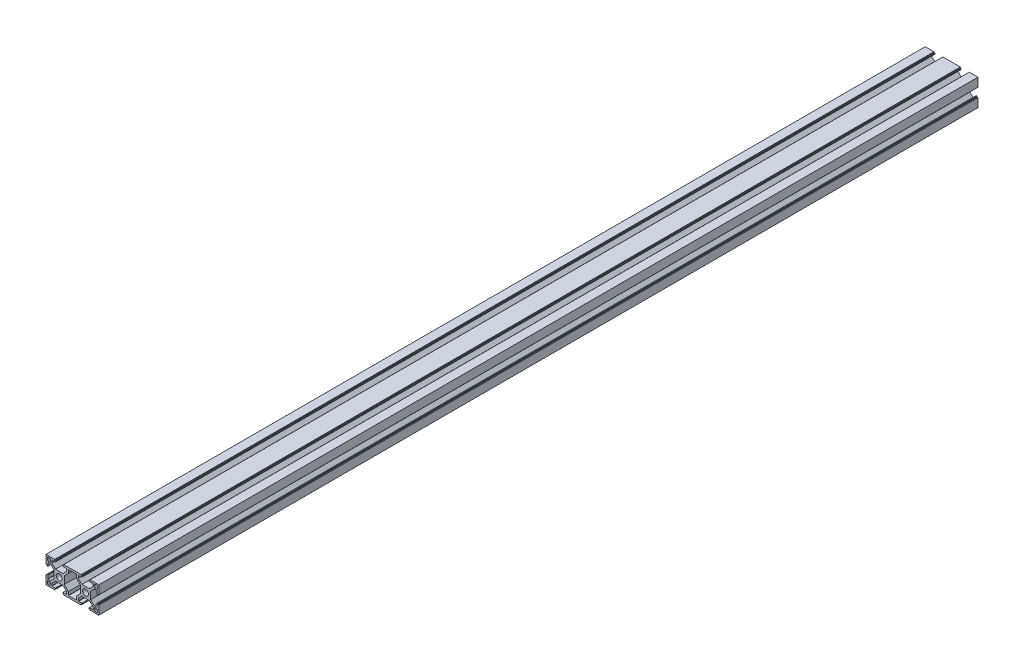
from build123d import *

# Parameters (mm, degrees)
SKETCH_1_R      = 3.4
EXTRUDE_1_DEPTH = 1000


with BuildPart() as part:
    # 草图1 → 凸台-拉伸1 (new body)
    with BuildSketch(Plane.XY):
        with BuildLine():
            Line((-34.860338488, 11.460591472), (-34.860338488, 4.060591472))
            Line((-34.860338488, 4.060591472), (-34.060338488, 4.060591472))
            ThreePointArc((-34.060338488, 4.060591472), (-33.918917132, 4.002012828), (-33.860338488, 3.860591472))
            Line((-33.860338488, 3.860591472), (-33.860338488, 3.060591472))
            Line((-33.860338488, 3.060591472), (-32.960338488, 3.060591472))
            ThreePointArc((-32.960338488, 3.060591472), (-32.748206454, 3.148459437), (-32.660338488, 3.360591472))
            Line((-32.660338488, 3.360591472), (-32.660338488, 6.910591472))
            ThreePointArc((-32.660338488, 6.910591472), (-32.572470523, 7.122723506), (-32.360338488, 7.210591472))
            Line((-32.360338488, 7.210591472), (-29.665973407, 7.210591472))
            Line((-29.665973407, 7.210591472), (-25.660338488, 3.204956553))
            Line((-25.660338488, 3.204956553), (-25.660338488, -5.28377361))
            Line((-25.660338488, -5.28377361), (-29.665973407, -9.289408528))
            Line((-29.665973407, -9.289408528), (-32.360338488, -9.289408528))
            ThreePointArc((-32.360338488, -9.289408528), (-32.572470523, -9.201540563), (-32.660338488, -8.989408528))
            Line((-32.660338488, -8.989408528), (-32.660338488, -5.439408528))
            ThreePointArc((-32.660338488, -5.439408528), (-32.748206454, -5.227276494), (-32.960338488, -5.139408528))
            Line((-32.960338488, -5.139408528), (-33.860338488, -5.139408528))
            Line((-33.860338488, -5.139408528), (-33.860338488, -5.939408528))
            ThreePointArc((-33.860338488, -5.939408528), (-33.918917132, -6.080829884), (-34.060338488, -6.139408528))
            Line((-34.060338488, -6.139408528), (-34.860338488, -6.139408528))
            Line((-34.860338488, -6.139408528), (-34.860338488, -13.539408528))
            Line((-34.860338488, -13.539408528), (-34.860338488, -16.039408528))
            Line((-34.860338488, -16.039408528), (-32.360338488, -16.039408528))
            Line((-32.360338488, -16.039408528), (-24.960338488, -16.039408528))
            Line((-24.960338488, -16.039408528), (-24.960338488, -15.239408528))
            ThreePointArc((-24.960338488, -15.239408528), (-24.901759845, -15.097987172), (-24.760338488, -15.039408528))
            Line((-24.760338488, -15.039408528), (-23.960338488, -15.039408528))
            Line((-23.960338488, -15.039408528), (-23.960338488, -14.139408528))
            ThreePointArc((-23.960338488, -14.139408528), (-24.048206454, -13.927276494), (-24.260338488, -13.839408528))
            Line((-24.260338488, -13.839408528), (-27.810338488, -13.839408528))
            ThreePointArc((-27.810338488, -13.839408528), (-28.022470523, -13.751540563), (-28.110338488, -13.539408528))
            Line((-28.110338488, -13.539408528), (-28.110338488, -10.845043447))
            Line((-28.110338488, -10.845043447), (-24.10470357, -6.839408528))
            Line((-24.10470357, -6.839408528), (-15.615973407, -6.839408528))
            Line((-15.615973407, -6.839408528), (-11.610338488, -10.845043447))
            Line((-11.610338488, -10.845043447), (-11.610338488, -13.539408528))
            ThreePointArc((-11.610338488, -13.539408528), (-11.698206454, -13.751540563), (-11.910338488, -13.839408528))
            Line((-11.910338488, -13.839408528), (-15.460338488, -13.839408528))
            ThreePointArc((-15.460338488, -13.839408528), (-15.672470523, -13.927276494), (-15.760338488, -14.139408528))
            Line((-15.760338488, -14.139408528), (-15.760338488, -15.039408528))
            Line((-15.760338488, -15.039408528), (-14.960338488, -15.039408528))
            ThreePointArc((-14.960338488, -15.039408528), (-14.818917132, -15.097987172), (-14.760338488, -15.239408528))
            Line((-14.760338488, -15.239408528), (-14.760338488, -16.039408528))
            Line((-14.760338488, -16.039408528), (-7.360338488, -16.039408528))
            Line((-7.360338488, -16.039408528), (-4.860338488, -16.039408528))
            Line((-4.860338488, -16.039408528), (-2.360338488, -16.039408528))
            Line((-2.360338488, -16.039408528), (5.039661512, -16.039408528))
            Line((5.039661512, -16.039408528), (5.039661512, -15.239408528))
            ThreePointArc((5.039661512, -15.239408528), (5.098240155, -15.097987172), (5.239661512, -15.039408528))
            Line((5.239661512, -15.039408528), (6.039661512, -15.039408528))
            Line((6.039661512, -15.039408528), (6.039661512, -14.139408528))
            ThreePointArc((6.039661512, -14.139408528), (5.951793546, -13.927276494), (5.739661512, -13.839408528))
            Line((5.739661512, -13.839408528), (2.189661512, -13.839408528))
            ThreePointArc((2.189661512, -13.839408528), (1.977529477, -13.751540563), (1.889661512, -13.539408528))
            Line((1.889661512, -13.539408528), (1.889661512, -10.845043447))
            Line((1.889661512, -10.845043447), (5.89529643, -6.839408528))
            Line((5.89529643, -6.839408528), (14.384026593, -6.839408528))
            Line((14.384026593, -6.839408528), (18.389661512, -10.845043447))
            Line((18.389661512, -10.845043447), (18.389661512, -13.539408528))
            ThreePointArc((18.389661512, -13.539408528), (18.301793546, -13.751540563), (18.089661512, -13.839408528))
            Line((18.089661512, -13.839408528), (14.539661512, -13.839408528))
            ThreePointArc((14.539661512, -13.839408528), (14.327529477, -13.927276494), (14.239661512, -14.139408528))
            Line((14.239661512, -14.139408528), (14.239661512, -15.039408528))
            Line((14.239661512, -15.039408528), (15.039661512, -15.039408528))
            ThreePointArc((15.039661512, -15.039408528), (15.181082868, -15.097987172), (15.239661512, -15.239408528))
            Line((15.239661512, -15.239408528), (15.239661512, -16.039408528))
            Line((15.239661512, -16.039408528), (22.639661512, -16.039408528))
            Line((22.639661512, -16.039408528), (25.139661512, -16.039408528))
            Line((25.139661512, -16.039408528), (25.139661512, -13.539408528))
            Line((25.139661512, -13.539408528), (25.139661512, -6.139408528))
            Line((25.139661512, -6.139408528), (24.339661512, -6.139408528))
            ThreePointArc((24.339661512, -6.139408528), (24.198240155, -6.080829884), (24.139661512, -5.939408528))
            Line((24.139661512, -5.939408528), (24.139661512, -5.139408528))
            Line((24.139661512, -5.139408528), (23.239661512, -5.139408528))
            ThreePointArc((23.239661512, -5.139408528), (23.027529477, -5.227276494), (22.939661512, -5.439408528))
            Line((22.939661512, -5.439408528), (22.939661512, -8.989408528))
            ThreePointArc((22.939661512, -8.989408528), (22.851793546, -9.201540563), (22.639661512, -9.289408528))
            Line((22.639661512, -9.289408528), (19.94529643, -9.289408528))
            Line((19.94529643, -9.289408528), (15.939661512, -5.28377361))
            Line((15.939661512, -5.28377361), (15.939661512, 3.204956553))
            Line((15.939661512, 3.204956553), (19.94529643, 7.210591472))
            Line((19.94529643, 7.210591472), (22.639661512, 7.210591472))
            ThreePointArc((22.639661512, 7.210591472), (22.851793546, 7.122723506), (22.939661512, 6.910591472))
            Line((22.939661512, 6.910591472), (22.939661512, 3.360591472))
            ThreePointArc((22.939661512, 3.360591472), (23.027529477, 3.148459437), (23.239661512, 3.060591472))
            Line((23.239661512, 3.060591472), (24.139661512, 3.060591472))
            Line((24.139661512, 3.060591472), (24.139661512, 3.860591472))
            ThreePointArc((24.139661512, 3.860591472), (24.198240155, 4.002012828), (24.339661512, 4.060591472))
            Line((24.339661512, 4.060591472), (25.139661512, 4.060591472))
            Line((25.139661512, 4.060591472), (25.139661512, 11.460591472))
            Line((25.139661512, 11.460591472), (25.139661512, 13.960591472))
            Line((25.139661512, 13.960591472), (22.639661512, 13.960591472))
            Line((22.639661512, 13.960591472), (15.239661512, 13.960591472))
            Line((15.239661512, 13.960591472), (15.239661512, 13.160591472))
            ThreePointArc((15.239661512, 13.160591472), (15.181082868, 13.019170116), (15.039661512, 12.960591472))
            Line((15.039661512, 12.960591472), (14.239661512, 12.960591472))
            Line((14.239661512, 12.960591472), (14.239661512, 12.060591472))
            ThreePointArc((14.239661512, 12.060591472), (14.327529477, 11.848459437), (14.539661512, 11.760591472))
            Line((14.539661512, 11.760591472), (18.089661512, 11.760591472))
            ThreePointArc((18.089661512, 11.760591472), (18.301793546, 11.672723506), (18.389661512, 11.460591472))
            Line((18.389661512, 11.460591472), (18.389661512, 8.76622639))
            Line((18.389661512, 8.76622639), (14.384026593, 4.760591472))
            Line((14.384026593, 4.760591472), (5.89529643, 4.760591472))
            Line((5.89529643, 4.760591472), (1.889661512, 8.76622639))
            Line((1.889661512, 8.76622639), (1.889661512, 11.460591472))
            ThreePointArc((1.889661512, 11.460591472), (1.977529477, 11.672723506), (2.189661512, 11.760591472))
            Line((2.189661512, 11.760591472), (5.739661512, 11.760591472))
            ThreePointArc((5.739661512, 11.760591472), (5.951793546, 11.848459437), (6.039661512, 12.060591472))
            Line((6.039661512, 12.060591472), (6.039661512, 12.960591472))
            Line((6.039661512, 12.960591472), (5.239661512, 12.960591472))
            ThreePointArc((5.239661512, 12.960591472), (5.098240155, 13.019170116), (5.039661512, 13.160591472))
            Line((5.039661512, 13.160591472), (5.039661512, 13.960591472))
            Line((5.039661512, 13.960591472), (-2.360338488, 13.960591472))
            Line((-2.360338488, 13.960591472), (-4.860338488, 13.960591472))
            Line((-4.860338488, 13.960591472), (-7.360338488, 13.960591472))
            Line((-7.360338488, 13.960591472), (-14.760338488, 13.960591472))
            Line((-14.760338488, 13.960591472), (-14.760338488, 13.160591472))
            ThreePointArc((-14.760338488, 13.160591472), (-14.818917132, 13.019170116), (-14.960338488, 12.960591472))
            Line((-14.960338488, 12.960591472), (-15.760338488, 12.960591472))
            Line((-15.760338488, 12.960591472), (-15.760338488, 12.060591472))
            ThreePointArc((-15.760338488, 12.060591472), (-15.672470523, 11.848459437), (-15.460338488, 11.760591472))
            Line((-15.460338488, 11.760591472), (-11.910338488, 11.760591472))
            ThreePointArc((-11.910338488, 11.760591472), (-11.698206454, 11.672723506), (-11.610338488, 11.460591472))
            Line((-11.610338488, 11.460591472), (-11.610338488, 8.76622639))
            Line((-11.610338488, 8.76622639), (-15.615973407, 4.760591472))
            Line((-15.615973407, 4.760591472), (-24.10470357, 4.760591472))
            Line((-24.10470357, 4.760591472), (-28.110338488, 8.76622639))
            Line((-28.110338488, 8.76622639), (-28.110338488, 11.460591472))
            ThreePointArc((-28.110338488, 11.460591472), (-28.022470523, 11.672723506), (-27.810338488, 11.760591472))
            Line((-27.810338488, 11.760591472), (-24.260338488, 11.760591472))
            ThreePointArc((-24.260338488, 11.760591472), (-24.048206454, 11.848459437), (-23.960338488, 12.060591472))
            Line((-23.960338488, 12.060591472), (-23.960338488, 12.960591472))
            Line((-23.960338488, 12.960591472), (-24.760338488, 12.960591472))
            ThreePointArc((-24.760338488, 12.960591472), (-24.901759845, 13.019170116), (-24.960338488, 13.160591472))
            Line((-24.960338488, 13.160591472), (-24.960338488, 13.960591472))
            Line((-24.960338488, 13.960591472), (-32.360338488, 13.960591472))
            Line((-32.360338488, 13.960591472), (-34.860338488, 13.960591472))
            Line((-34.860338488, 13.960591472), (-34.860338488, 11.460591472))
        make_face()
        with Locations((-19.860338488, -1.039408528)):
            Circle(SKETCH_1_R, mode=Mode.SUBTRACT)
        with Locations((10.139661512, -1.039408528)):
            Circle(SKETCH_1_R, mode=Mode.SUBTRACT)
        with BuildLine():
            Line((-29.610338488, -11.789408528), (-29.610338488, -13.539408528))
            ThreePointArc((-29.610338488, -13.539408528), (-29.903231707, -14.246515309), (-30.610338488, -14.539408528))
            Line((-30.610338488, -14.539408528), (-32.360338488, -14.539408528))
            ThreePointArc((-32.360338488, -14.539408528), (-33.06744527, -14.246515309), (-33.360338488, -13.539408528))
            Line((-33.360338488, -13.539408528), (-33.360338488, -11.789408528))
            ThreePointArc((-33.360338488, -11.789408528), (-33.06744527, -11.082301747), (-32.360338488, -10.789408528))
            Line((-32.360338488, -10.789408528), (-30.610338488, -10.789408528))
            ThreePointArc((-30.610338488, -10.789408528), (-29.903231707, -11.082301747), (-29.610338488, -11.789408528))
        make_face(mode=Mode.SUBTRACT)
        with BuildLine():
            Line((-30.610338488, 8.710591472), (-32.360338488, 8.710591472))
            ThreePointArc((-32.360338488, 8.710591472), (-33.06744527, 9.003484691), (-33.360338488, 9.710591472))
            Line((-33.360338488, 9.710591472), (-33.360338488, 11.460591472))
            ThreePointArc((-33.360338488, 11.460591472), (-33.06744527, 12.167698253), (-32.360338488, 12.460591472))
            Line((-32.360338488, 12.460591472), (-30.610338488, 12.460591472))
            ThreePointArc((-30.610338488, 12.460591472), (-29.903231707, 12.167698253), (-29.610338488, 11.460591472))
            Line((-29.610338488, 11.460591472), (-29.610338488, 9.710591472))
            ThreePointArc((-29.610338488, 9.710591472), (-29.903231707, 9.003484691), (-30.610338488, 8.710591472))
        make_face(mode=Mode.SUBTRACT)
        with BuildLine():
            Line((-14.060338488, -5.28377361), (-14.060338488, 3.204956553))
            Line((-14.060338488, 3.204956553), (-9.410338488, 7.854956553))
            Line((-9.410338488, 7.854956553), (-9.410338488, 11.460591472))
            ThreePointArc((-9.410338488, 11.460591472), (-9.322470523, 11.672723506), (-9.110338488, 11.760591472))
            Line((-9.110338488, 11.760591472), (-0.610338488, 11.760591472))
            ThreePointArc((-0.610338488, 11.760591472), (-0.398206454, 11.672723506), (-0.310338488, 11.460591472))
            Line((-0.310338488, 11.460591472), (-0.310338488, 7.854956553))
            Line((-0.310338488, 7.854956553), (4.339661512, 3.204956553))
            Line((4.339661512, 3.204956553), (4.339661512, -5.28377361))
            Line((4.339661512, -5.28377361), (-0.310338488, -9.93377361))
            Line((-0.310338488, -9.93377361), (-0.310338488, -13.539408528))
            ThreePointArc((-0.310338488, -13.539408528), (-0.398206454, -13.751540563), (-0.610338488, -13.839408528))
            Line((-0.610338488, -13.839408528), (-9.110338488, -13.839408528))
            ThreePointArc((-9.110338488, -13.839408528), (-9.322470523, -13.751540563), (-9.410338488, -13.539408528))
            Line((-9.410338488, -13.539408528), (-9.410338488, -9.93377361))
            Line((-9.410338488, -9.93377361), (-14.060338488, -5.28377361))
        make_face(mode=Mode.SUBTRACT)
        with BuildLine():
            Line((19.889661512, 9.710591472), (19.889661512, 11.460591472))
            ThreePointArc((19.889661512, 11.460591472), (20.18255473, 12.167698253), (20.889661512, 12.460591472))
            Line((20.889661512, 12.460591472), (22.639661512, 12.460591472))
            ThreePointArc((22.639661512, 12.460591472), (23.346768293, 12.167698253), (23.639661512, 11.460591472))
            Line((23.639661512, 11.460591472), (23.639661512, 9.710591472))
            ThreePointArc((23.639661512, 9.710591472), (23.346768293, 9.003484691), (22.639661512, 8.710591472))
            Line((22.639661512, 8.710591472), (20.889661512, 8.710591472))
            ThreePointArc((20.889661512, 8.710591472), (20.18255473, 9.003484691), (19.889661512, 9.710591472))
        make_face(mode=Mode.SUBTRACT)
        with BuildLine():
            Line((20.889661512, -10.789408528), (22.639661512, -10.789408528))
            ThreePointArc((22.639661512, -10.789408528), (23.346768293, -11.082301747), (23.639661512, -11.789408528))
            Line((23.639661512, -11.789408528), (23.639661512, -13.539408528))
            ThreePointArc((23.639661512, -13.539408528), (23.346768293, -14.246515309), (22.639661512, -14.539408528))
            Line((22.639661512, -14.539408528), (20.889661512, -14.539408528))
            ThreePointArc((20.889661512, -14.539408528), (20.18255473, -14.246515309), (19.889661512, -13.539408528))
            Line((19.889661512, -13.539408528), (19.889661512, -11.789408528))
            ThreePointArc((19.889661512, -11.789408528), (20.18255473, -11.082301747), (20.889661512, -10.789408528))
        make_face(mode=Mode.SUBTRACT)
    extrude(amount=EXTRUDE_1_DEPTH)


solid = part.part
